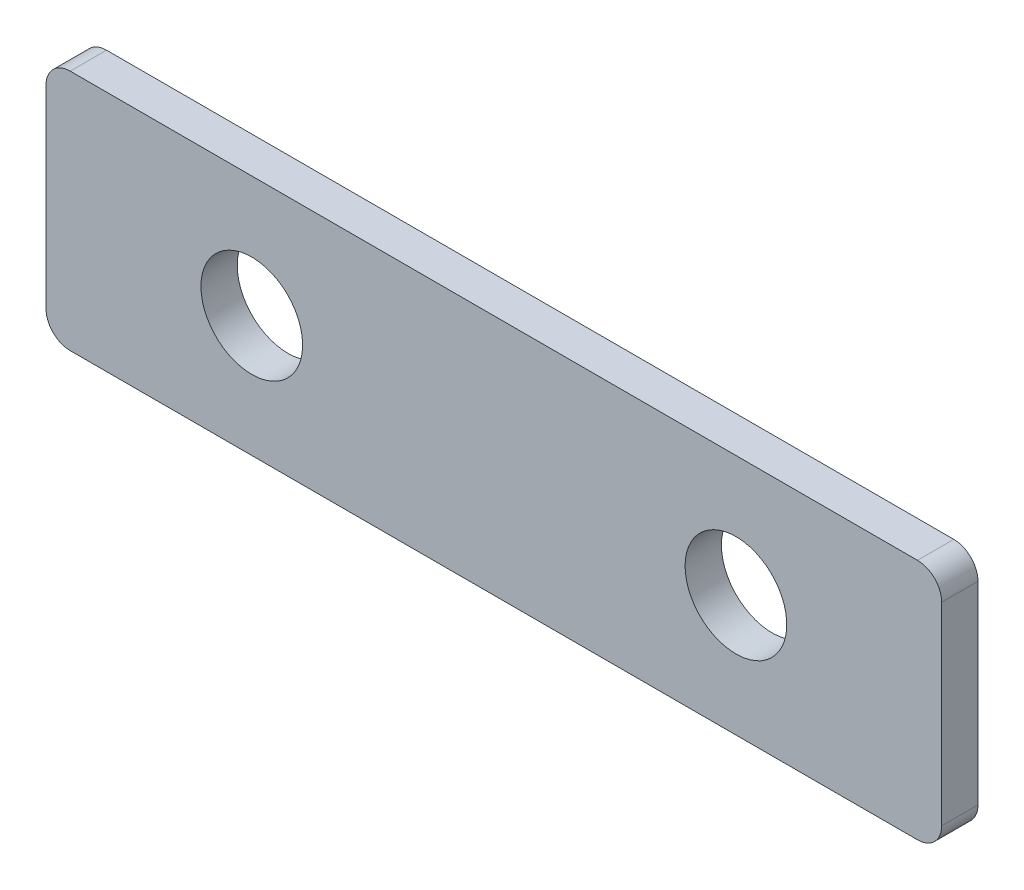
from build123d import *

# Parameters (mm, degrees)
SKETCH1_R           = 2.1
BOSS_EXTRUDE1_DEPTH = 1.5


with BuildPart() as part:
    # Sketch1 → Boss-Extrude1 (new body)
    with BuildSketch(Plane.XY):
        with BuildLine():
            Line((-17.5, -5), (17.5, -5))
            ThreePointArc((17.5, -5), (18.207106781, -4.707106781), (18.5, -4))
            Line((18.5, -4), (18.5, 4))
            ThreePointArc((18.5, 4), (18.207106781, 4.707106781), (17.5, 5))
            Line((17.5, 5), (-17.5, 5))
            ThreePointArc((-17.5, 5), (-18.207106781, 4.707106781), (-18.5, 4))
            Line((-18.5, 4), (-18.5, -4))
            ThreePointArc((-18.5, -4), (-18.207106781, -4.707106781), (-17.5, -5))
        make_face()
        with Locations(Location((-10, 0, 0), (0, 0, 180))):
            Circle(SKETCH1_R, mode=Mode.SUBTRACT)
        with Locations(Location((10, 0, 0), (0, 0, 180))):
            Circle(SKETCH1_R, mode=Mode.SUBTRACT)
    extrude(amount=BOSS_EXTRUDE1_DEPTH)


solid = part.part
